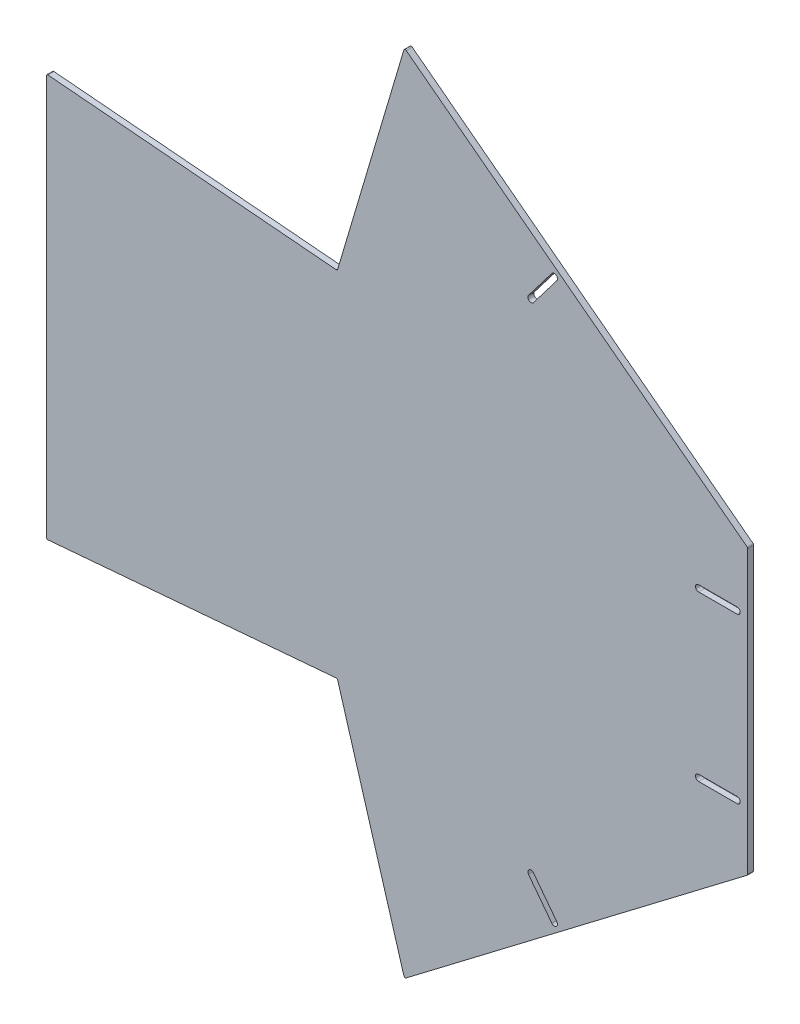
from build123d import *

# Parameters (mm, degrees)
BOSS_EXTRUDE1_DEPTH = 4
FILLET1_R           = 1


with BuildPart() as part:
    # Sketch1 → Boss-Extrude1 (new body)
    # profile 1 of 3: a face of its own
    with BuildSketch(Plane(origin=(0, 0, 0), x_dir=(0, 1, 0), z_dir=(0, 0, 1))):
        Polygon((-23.404255319, 275), (0, 0), (190, 0), (213.404255319, 275), (230, 470), (-40, 470), align=None)
        with BuildLine():
            ThreePointArc((37.9, 32.9), (40, 35), (42.1, 32.9))
            Line((42.1, 32.9), (42.1, 7.1))
            ThreePointArc((42.1, 7.1), (40, 5), (37.9, 7.1))
            Line((37.9, 7.1), (37.9, 32.9))
        make_face(mode=Mode.SUBTRACT)
        with BuildLine():
            Line((147.9, 7.1), (147.9, 32.9))
            ThreePointArc((147.9, 32.9), (150, 35), (152.1, 32.9))
            Line((152.1, 32.9), (152.1, 7.1))
            ThreePointArc((152.1, 7.1), (150, 5), (147.9, 7.1))
        make_face(mode=Mode.SUBTRACT)
    # profile 2 of 3: a face of its own
    with BuildSketch(Plane(origin=(0, 0, 0), x_dir=(0, 1, 0), z_dir=(0, 0, 1))):
        Polygon((-175, 230), (0, 0), (-23.404255319, 275), align=None)
        with BuildLine():
            ThreePointArc((-91.031422458, 127.898638669), (-93.974258564, 128.298283078), (-93.574614155, 131.241119184))
            Line((-93.574614155, 131.241119184), (-73.042233846, 146.863582462))
            ThreePointArc((-73.042233846, 146.863582462), (-70.099397741, 146.463938053), (-70.49904215, 143.521101947))
            Line((-70.49904215, 143.521101947), (-91.031422458, 127.898638669))
        make_face(mode=Mode.SUBTRACT)
    # profile 3 of 3: a face of its own
    with BuildSketch(Plane(origin=(0, 0, 0), x_dir=(0, 1, 0), z_dir=(0, 0, 1))):
        Polygon((213.404255319, 275), (190, 0), (365, 230), align=None)
        with BuildLine():
            Line((263.042233846, 146.863582462), (283.574614155, 131.241119184))
            ThreePointArc((283.574614155, 131.241119184), (283.974258564, 128.298283078), (281.031422458, 127.898638669))
            Line((281.031422458, 127.898638669), (260.49904215, 143.521101947))
            ThreePointArc((260.49904215, 143.521101947), (260.099397741, 146.463938053), (263.042233846, 146.863582462))
        make_face(mode=Mode.SUBTRACT)
    extrude(amount=BOSS_EXTRUDE1_DEPTH)

    # Fillet1
    fillet1_edges = [part.edges().sort_by_distance(p)[0] for p in [
        (-275, -23.404255319, 2),
        (-470, -40, 2),
        (-470, 230, 2),
        (-275, 213.404255319, 2),
        (-230, 365, 2),
        (0, 190, 2),
        (0, 0, 2),
        (-230, -175, 2),
    ]]
    fillet(fillet1_edges, radius=FILLET1_R)


solid = part.part
